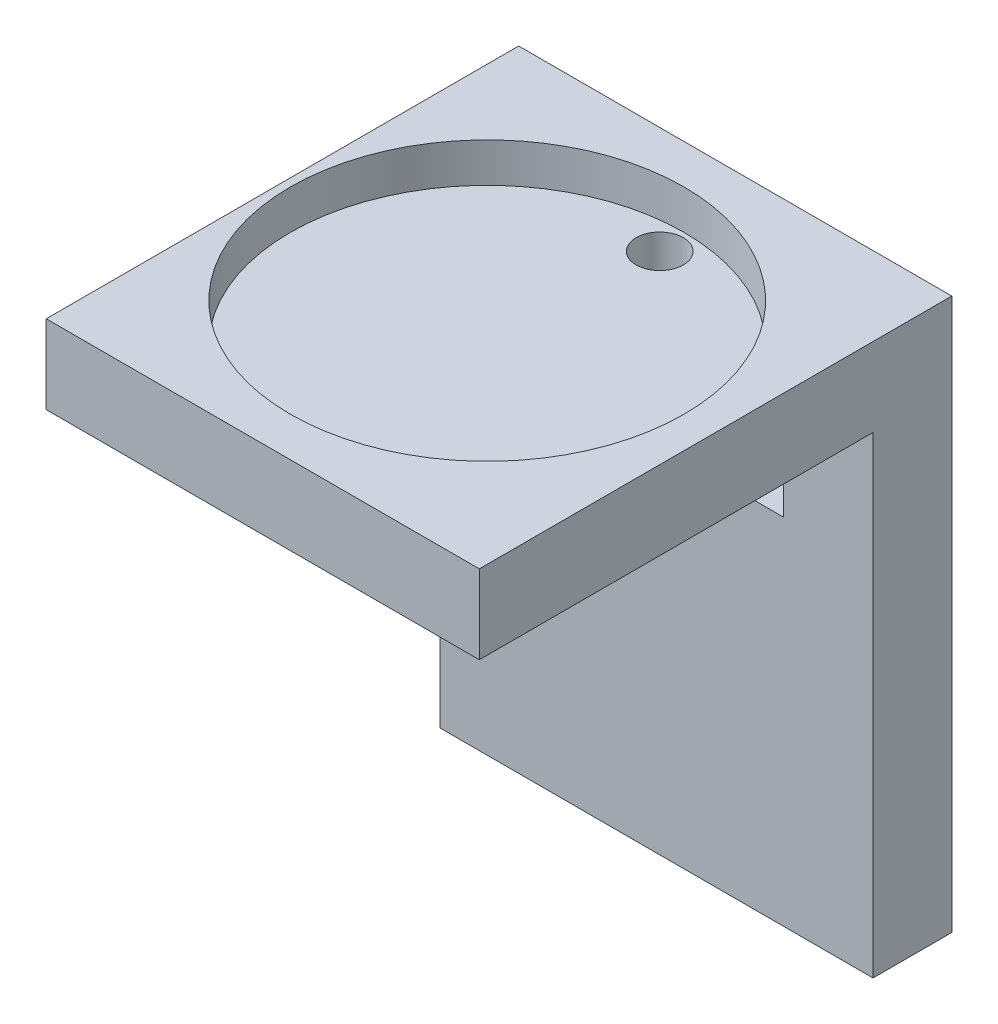
from build123d import *

# Parameters (mm, degrees)
SKETCH1_W                      = 670
SKETCH1_H                      = 120
BOSS_EXTRUDE1_DEPTH            = 530
SKETCH2_W                      = 100
SKETCH2_H                      = 200
SKETCH2_W_2                    = 650
SKETCH2_H_2                    = 250
CUT_EXTRUDE1_DEPTH             = 100
SKETCH3_R                      = 50
CUT_EXTRUDE2_DEPTH             = 260
F_12_0_12_DIAMETER_HOLE2_D     = 12
F_12_0_12_DIAMETER_HOLE2_DEPTH = 30
F_12_0_12_DIAMETER_HOLE2_TIP   = 3.605163714
SKETCH8_W                      = 650
SKETCH8_H                      = 50
BOSS_EXTRUDE2_DEPTH            = 5
SKETCH9_W                      = 10
SKETCH9_H                      = 250
CUT_EXTRUDE3_DEPTH             = 717
CUT_EXTRUDE4_DEPTH             = 5
SKETCH11_W                     = 10
SKETCH11_H                     = 100
BOSS_EXTRUDE3_DEPTH            = 78
BOSS_EXTRUDE3_2_DEPTH          = 78
BOSS_EXTRUDE3_3_DEPTH          = 78
SKETCH12_W                     = 20
SKETCH12_H                     = 30
CUT_EXTRUDE5_DEPTH             = 80
SKETCH15_W                     = 30
SKETCH15_H                     = 23.536156656
SKETCH15_H_2                   = 28.986603691
CUT_EXTRUDE7_DEPTH             = 35
SHELL1_T                       = -3
SKETCH16_W                     = 14
SKETCH16_H                     = 14
CUT_EXTRUDE8_DEPTH             = 35
SKETCH17_W                     = 5.729882812
SKETCH17_H                     = 17.428393554
SKETCH17_W_2                   = 13.369726562
SKETCH17_H_2                   = 3.342431641
BOSS_EXTRUDE4_DEPTH            = 5
CUT_EXTRUDE10_DEPTH            = 863.670273187
CUT_EXTRUDE10_DEPTH_BACK       = 863.670273187
SKETCH18_W                     = 670
SKETCH18_H                     = 250
CUT_EXTRUDE11_DEPTH            = 737.002717386
CUT_EXTRUDE11_DEPTH_BACK       = 737.002717386
SKETCH19_W                     = 222
SKETCH19_H                     = 280
SKETCH19_W_2                   = 338
CUT_EXTRUDE12_DEPTH            = 538.683922021
CUT_EXTRUDE12_DEPTH_BACK       = 538.683922021
SKETCH20_W                     = 110
SKETCH20_H                     = 140


with BuildPart() as part:
    # Sketch1 → Boss-Extrude1 (new body)
    with BuildSketch(Plane(origin=(0, 0, 0), x_dir=(1, 0, 0), z_dir=(0, 1, 0))):
        with Locations((335, 60)):
            Rectangle(SKETCH1_W, SKETCH1_H)
    extrude(amount=BOSS_EXTRUDE1_DEPTH)

    # Sketch2 → Cut-Extrude1 (cut)
    with BuildSketch(Plane.XY):
        with Locations((60, 380)):
            Rectangle(SKETCH2_W, SKETCH2_H)
        with Locations((170, 380)):
            Rectangle(SKETCH2_W, SKETCH2_H)
        with Locations((280, 380)):
            Rectangle(SKETCH2_W, SKETCH2_H)
        with Locations((390, 380)):
            Rectangle(SKETCH2_W, SKETCH2_H)
        with Locations((500, 380)):
            Rectangle(SKETCH2_W, SKETCH2_H)
        with Locations((610, 380)):
            Rectangle(SKETCH2_W, SKETCH2_H)
        with Locations((335, 135)):
            Rectangle(SKETCH2_W_2, SKETCH2_H_2)
    extrude(amount=-CUT_EXTRUDE1_DEPTH, mode=Mode.SUBTRACT)

    # Sketch3 → Cut-Extrude2 (cut)
    with BuildSketch(Plane(origin=(0, 530, 0), x_dir=(1, 0, 0), z_dir=(0, 1, 0))):
        with Locations((60, 60)):
            Circle(SKETCH3_R)
        with Locations((170, 60)):
            Circle(SKETCH3_R)
        with Locations((280, 60)):
            Circle(SKETCH3_R)
        with Locations((390, 60)):
            Circle(SKETCH3_R)
        with Locations((500, 60)):
            Circle(SKETCH3_R)
        with Locations((610, 60)):
            Circle(SKETCH3_R)
    extrude(amount=-CUT_EXTRUDE2_DEPTH, mode=Mode.SUBTRACT)

    # Ø12.0 (12) Diameter Hole2
    with Locations(Plane(origin=(59.704642413, 270, -102.411697903), x_dir=(0, 0, 1), z_dir=(0, 1, 0))):
        with Locations((0, 0), (-0.195888006, 111.8520513), (0.014838595, 221.167624818), (-0.341843303, 331.364008353), (0.657723149, 441.008646429), (1.288998006, 549.811854685)):
            Hole(F_12_0_12_DIAMETER_HOLE2_D / 2, depth=F_12_0_12_DIAMETER_HOLE2_DEPTH)
            with Locations((0, 0, -(F_12_0_12_DIAMETER_HOLE2_DEPTH + F_12_0_12_DIAMETER_HOLE2_TIP / 2))):  # 118° drill point
                Cone(0, F_12_0_12_DIAMETER_HOLE2_D / 2, F_12_0_12_DIAMETER_HOLE2_TIP, mode=Mode.SUBTRACT)

    # Sketch8 → Boss-Extrude2 (add)
    with BuildSketch(Plane.XY):
        with Locations((335, 305)):
            Rectangle(SKETCH8_W, SKETCH8_H)
    extrude(amount=-BOSS_EXTRUDE2_DEPTH)

    # Sketch9 → Cut-Extrude3 (cut)
    with BuildSketch(Plane(origin=(670, 0, 0), x_dir=(0, 0, -1), z_dir=(1, 0, 0))):
        with Locations((15, 135)):
            Rectangle(SKETCH9_W, SKETCH9_H)
    extrude(amount=-CUT_EXTRUDE3_DEPTH, mode=Mode.SUBTRACT)

    # Sketch10 → Cut-Extrude4 (cut)
    with BuildSketch(Plane(origin=(0, 10, 0), x_dir=(1, 0, 0), z_dir=(0, 1, 0))):
        Polygon((365, 61.943560596), (350, 87.924322709), (320, 87.924322709), (305, 61.943560596), (320, 35.962798482), (350, 35.962798482), align=None)
    extrude(amount=-CUT_EXTRUDE4_DEPTH, mode=Mode.SUBTRACT)

    # Sketch12 → Cut-Extrude5 (cut)
    with BuildSketch(Plane.XY.offset(-100)):
        with Locations((85.198613037, 245)):
            Rectangle(SKETCH12_W, SKETCH12_H)
        with Locations((195.198613037, 245)):
            Rectangle(SKETCH12_W, SKETCH12_H)
        with Locations((305.198613037, 245)):
            Rectangle(SKETCH12_W, SKETCH12_H)
        with Locations((415.198613037, 245)):
            Rectangle(SKETCH12_W, SKETCH12_H)
        with Locations((525.198613037, 245)):
            Rectangle(SKETCH12_W, SKETCH12_H)
        with Locations((635.198613037, 245)):
            Rectangle(SKETCH12_W, SKETCH12_H)
    extrude(amount=-CUT_EXTRUDE5_DEPTH, mode=Mode.SUBTRACT)

    # Sketch17 → Boss-Extrude4 (add)
    # profile 1 of 9: a face of its own
    with BuildSketch(Plane.XY):
        with BuildLine():
            Line((527.508830928, 289.835452458), (527.508830928, 307.263846012))
            Line((527.508830928, 307.263846012), (534.861434459, 307.263846012))
            add(Edge.make_bspline(
                [(534.861434459, 307.263846012), (535.181337774, 307.258256848), (535.803061116, 307.24739446), (536.703508491, 307.139069344), (537.544992916, 306.975202489), (538.325061607, 306.737496792), (539.040841948, 306.426020155), (539.698044515, 306.051894954), (540.290333057, 305.605079277), (540.822348212, 305.090232636), (541.284521701, 304.502523111), (541.692171296, 303.852565801), (542.030284458, 303.129762281), (542.309377095, 302.341316546), (542.5243908, 301.484161689), (542.679660381, 300.560045938), (542.773357357, 299.567500804), (542.783368073, 298.883107022), (542.788518428, 298.530997273)],
                knots=[0, 0, 0, 0, 1.135059408, 2.20595691, 3.214417064, 4.174978569, 5.094187092, 5.980001006, 6.853065862, 7.720814779, 8.600404634, 9.50058483, 10.438414914, 11.426825708, 12.465239141, 13.571113463, 14.750376389, 16, 16, 16, 16], degree=3))
            add(Edge.make_bspline(
                [(542.788518428, 298.530997273), (542.781740751, 298.180151665), (542.768592871, 297.499553336), (542.676885992, 296.511518461), (542.516733301, 295.591080531), (542.296748778, 294.736450427), (542.003051046, 293.953120444), (541.654236167, 293.233205539), (541.233025793, 292.585291498), (540.753136904, 292.000029304), (540.204772188, 291.484681411), (539.587651059, 291.044279297), (538.910779309, 290.668464036), (538.169670382, 290.361903209), (537.364073889, 290.124869172), (536.495133477, 289.954199984), (535.562644449, 289.853487388), (534.920131033, 289.841584621), (534.58911581, 289.835452458)],
                knots=[0, 0, 0, 0, 1.228418252, 2.382983832, 3.470276728, 4.496757894, 5.468023682, 6.394867725, 7.292157164, 8.167372942, 9.039072913, 9.918728341, 10.815246345, 11.744296628, 12.720973084, 13.750736166, 14.841206188, 16, 16, 16, 16], degree=3))
            Line((534.58911581, 289.835452458), (527.508830928, 289.835452458))
        make_face()
        with BuildLine():
            Line((533.238713741, 291.745413395), (534.048208904, 291.745413395))
            add(Edge.make_bspline(
                [(534.048208904, 291.745413395), (534.172894012, 291.749291978), (534.413033311, 291.756761998), (534.758676231, 291.825976613), (535.075745017, 291.938271137), (535.365749176, 292.094802589), (535.623404602, 292.300450923), (535.848862806, 292.551404902), (536.04776914, 292.844737637), (536.217685755, 293.190205032), (536.364284647, 293.596533622), (536.481764702, 294.076367921), (536.592118304, 294.630928744), (536.673672739, 295.265507643), (536.740044562, 295.978448886), (536.788346679, 296.768428292), (536.812018936, 297.636801208), (536.817188964, 298.241258393), (536.819890499, 298.55711002)],
                knots=[0, 0, 0, 0, 0.728710832, 1.403472396, 2.052289494, 2.690292559, 3.321919393, 3.970736491, 4.656696891, 5.388631723, 6.217040872, 7.17856157, 8.275589967, 9.523440737, 10.918935818, 12.463926104, 14.152268318, 16, 16, 16, 16], degree=3))
            add(Edge.make_bspline(
                [(536.819890499, 298.55711002), (536.8171426, 298.871715251), (536.811863063, 299.476166083), (536.7886758, 300.343334385), (536.739579947, 301.133216935), (536.674703848, 301.843934916), (536.589660404, 302.476324031), (536.488366458, 303.031681737), (536.362441588, 303.507627045), (536.222158727, 303.914921549), (536.050140993, 304.256514038), (535.858357073, 304.554097881), (535.62547107, 304.79746827), (535.36991257, 305.004888479), (535.079348843, 305.160875844), (534.761320266, 305.273944358), (534.414185903, 305.34216807), (534.172870641, 305.349893944), (534.048208904, 305.353885075)],
                knots=[0, 0, 0, 0, 1.842836665, 3.540640921, 5.080358154, 6.47765669, 7.719902824, 8.816971715, 9.781579111, 10.601733135, 11.334613876, 12.017393917, 12.666641099, 13.29908421, 13.937911793, 14.587567384, 15.270347425, 16, 16, 16, 16], degree=3))
            Line((534.048208904, 305.353885075), (533.238713741, 305.353885075))
            Line((533.238713741, 305.353885075), (533.238713741, 291.745413395))
        make_face(mode=Mode.SUBTRACT)
    # profile 2 of 9: a face of its own
    with BuildSketch(Plane.XY):
        with Locations((547.563420772, 298.549649235)):
            Rectangle(SKETCH17_W, SKETCH17_H)
    # profile 3 of 9: a face of its own
    with BuildSketch(Plane.XY):
        Polygon((564.514324092, 307.263846012), (564.514324092, 305.115139958), (558.545696163, 305.115139958), (558.545696163, 299.862747379), (563.559343624, 299.862747379), (563.559343624, 297.714041325), (558.545696163, 297.714041325), (558.545696163, 289.835452458), (552.81581335, 289.835452458), (552.81581335, 307.263846012), align=None)
    # profile 4 of 9: a face of its own
    with BuildSketch(Plane.XY):
        Polygon((577.645305538, 307.263846012), (577.645305538, 305.115139958), (571.676677608, 305.115139958), (571.676677608, 299.862747379), (576.690325069, 299.862747379), (576.690325069, 297.714041325), (571.676677608, 297.714041325), (571.676677608, 289.835452458), (565.946794795, 289.835452458), (565.946794795, 307.263846012), align=None)
    # profile 5 of 9: a face of its own
    with BuildSketch(Plane.XY):
        with Locations((584.330168819, 287.448001286)):
            Rectangle(SKETCH17_W_2, SKETCH17_H_2)
    # profile 6 of 9: a face of its own
    with BuildSketch(Plane.XY):
        with BuildLine():
            Line((605.578484249, 307.263846012), (605.578484249, 295.602639195))
            add(Edge.make_bspline(
                [(605.578484249, 295.602639195), (605.574209777, 295.35989389), (605.565919345, 294.889083964), (605.480877158, 294.20653885), (605.349958188, 293.569747554), (605.15926554, 292.978838165), (604.911867049, 292.436847071), (604.616163877, 291.936663973), (604.260702644, 291.487723021), (603.847299908, 291.08966617), (603.386881991, 290.731670113), (602.867295001, 290.425440037), (602.293741958, 290.168488385), (601.66690529, 289.960990771), (600.988052682, 289.797299786), (600.254912883, 289.679078851), (599.467035781, 289.60781007), (598.923618241, 289.60048219), (598.643684673, 289.59670734)],
                knots=[0, 0, 0, 0, 1.108173197, 2.149326602, 3.136215123, 4.073726706, 4.978516626, 5.852185058, 6.72141202, 7.584905625, 8.467554395, 9.379216169, 10.332422268, 11.332766067, 12.390653242, 13.518530507, 14.721707419, 16, 16, 16, 16], degree=3))
            add(Edge.make_bspline(
                [(598.643684673, 289.59670734), (598.373688491, 289.600411437), (597.851346557, 289.607577482), (597.093280473, 289.679448684), (596.387523889, 289.797736542), (595.733050135, 289.960122315), (595.130189942, 290.169220301), (594.579048171, 290.42623041), (594.078350789, 290.732835498), (593.633858028, 291.090104794), (593.234289459, 291.486851767), (592.899913678, 291.940746827), (592.609043638, 292.435866034), (592.375223767, 292.980322997), (592.191754821, 293.570441519), (592.063541006, 294.20666921), (591.983676196, 294.889343196), (591.974661767, 295.359932437), (591.970012569, 295.602639195)],
                knots=[0, 0, 0, 0, 1.258901956, 2.435505865, 3.547148904, 4.59359074, 5.576649289, 6.5183682, 7.424469602, 8.307507093, 9.172751023, 10.042627298, 10.928839176, 11.845659241, 12.799442865, 13.80597989, 14.868432463, 16, 16, 16, 16], degree=3))
            Line((591.970012569, 295.602639195), (591.970012569, 307.263846012))
            Line((591.970012569, 307.263846012), (597.699895381, 307.263846012))
            Line((597.699895381, 307.263846012), (597.699895381, 295.457153889))
            add(Edge.make_bspline(
                [(597.699895381, 295.457153889), (597.700816195, 295.287996189), (597.702584578, 294.963135903), (597.729908723, 294.499051493), (597.768241004, 294.079064133), (597.828226169, 293.705517832), (597.90066041, 293.377063412), (597.989882091, 293.09281535), (598.094998068, 292.852496478), (598.225239063, 292.654232043), (598.380826623, 292.495135011), (598.55368342, 292.353231761), (598.757556996, 292.238543846), (598.987648905, 292.146224908), (599.243380948, 292.070549638), (599.526120553, 292.020376099), (599.83553351, 291.990763905), (600.049971942, 291.986424568), (600.161954402, 291.984158512)],
                knots=[0, 0, 0, 0, 1.622370975, 3.115695595, 4.458049099, 5.666011203, 6.742434742, 7.681714947, 8.519814998, 9.250928664, 9.942747364, 10.646898194, 11.389596108, 12.175933929, 13.021386247, 13.943159715, 14.925891993, 16, 16, 16, 16], degree=3))
            add(Edge.make_bspline(
                [(600.161954402, 291.984158512), (600.283927219, 291.987190593), (600.521124756, 291.993087005), (600.86597014, 292.03390861), (601.187714881, 292.103380086), (601.484890424, 292.205377303), (601.758665297, 292.332852529), (602.012761516, 292.484567923), (602.236391413, 292.674631152), (602.439076761, 292.888441291), (602.620738276, 293.128529789), (602.771757722, 293.399928575), (602.905501548, 293.697121508), (603.005823683, 294.025060118), (603.089837826, 294.379999499), (603.146989706, 294.763086929), (603.186210275, 295.174074524), (603.189394751, 295.457053988), (603.191033077, 295.602639195)],
                knots=[0, 0, 0, 0, 1.083870311, 2.107775948, 3.08105344, 4.003637981, 4.893545291, 5.761570557, 6.624657808, 7.49233129, 8.376387281, 9.291996285, 10.246843261, 11.267344133, 12.334180325, 13.486053461, 14.706643157, 16, 16, 16, 16], degree=3))
            Line((603.191033077, 295.602639195), (603.191033077, 307.263846012))
            Line((603.191033077, 307.263846012), (605.578484249, 307.263846012))
        make_face()
    # profile 7 of 9: a face of its own
    with BuildSketch(Plane.XY):
        with BuildLine():
            Line((619.731593227, 302.015183827), (616.739818477, 301.526502415))
            add(Edge.make_bspline(
                [(616.739818477, 301.526502415), (616.748849224, 301.670726223), (616.765660669, 301.939210177), (616.78429066, 302.312269209), (616.796668381, 302.625642376), (616.798628236, 302.814722915), (616.799504756, 302.899286839)],
                knots=[0, 0, 0, 0, 1.261802504, 2.348944521, 3.261585937, 4, 4, 4, 4], degree=3))
            add(Edge.make_bspline(
                [(616.799504756, 302.899286839), (616.798306068, 303.007660677), (616.795968139, 303.219033721), (616.750451916, 303.523894877), (616.694806916, 303.811547356), (616.604352699, 304.076787391), (616.488181329, 304.320314265), (616.348943917, 304.543955606), (616.184187178, 304.745078709), (615.995833421, 304.928129987), (615.778009957, 305.083200131), (615.536269472, 305.218702836), (615.269765326, 305.333844758), (614.978065514, 305.431346685), (614.660683072, 305.504624438), (614.319025281, 305.556776695), (613.952471696, 305.585673441), (613.699597795, 305.590260771), (613.568984889, 305.592630192)],
                knots=[0, 0, 0, 0, 1.079280541, 2.105035848, 3.067950317, 3.99715044, 4.889989748, 5.753421302, 6.617030865, 7.476358039, 8.364190572, 9.274590025, 10.235106994, 11.254473582, 12.337095886, 13.478601727, 14.697662529, 16, 16, 16, 16], degree=3))
            add(Edge.make_bspline(
                [(613.568984889, 305.592630192), (613.391954632, 305.58912286), (613.059112606, 305.582528579), (612.595688488, 305.495339748), (612.198743126, 305.361419257), (611.87165349, 305.163811893), (611.613188167, 304.909795747), (611.433841092, 304.593316589), (611.323009072, 304.224665915), (611.313400221, 303.959558324), (611.308367061, 303.820693775)],
                knots=[0, 0, 0, 0, 1.294917039, 2.43462794, 3.440028966, 4.347597256, 5.210608309, 6.06356377, 6.985685997, 8, 8, 8, 8], degree=3))
            add(Edge.make_bspline(
                [(611.308367061, 303.820693775), (611.317562032, 303.705133219), (611.336106628, 303.472068433), (611.47315858, 303.132808312), (611.695999602, 302.811560885), (612.009295906, 302.510664216), (612.404107796, 302.221967273), (612.884407504, 301.948533431), (613.450813789, 301.688189695), (613.862519081, 301.536023727), (614.080048656, 301.455624958)],
                knots=[0, 0, 0, 0, 0.716839541, 1.445735977, 2.240793036, 3.131329288, 4.131129903, 5.273471266, 6.559404876, 8, 8, 8, 8], degree=3))
            add(Edge.make_bspline(
                [(614.080048656, 301.455624958), (614.335934702, 301.364918412), (614.834564244, 301.188164095), (615.547657928, 300.88707802), (616.213068388, 300.5749594), (616.829579094, 300.246613346), (617.397833174, 299.90520698), (617.914851624, 299.544556457), (618.386199073, 299.173962102), (618.807001026, 298.783874588), (619.177995113, 298.378100064), (619.4958685, 297.952745357), (619.771807525, 297.51723103), (619.991113975, 297.061458502), (620.169645242, 296.594624218), (620.292698657, 296.11024444), (620.364288243, 295.609761088), (620.37516617, 295.270864226), (620.380681514, 295.099036213)],
                knots=[0, 0, 0, 0, 1.359488612, 2.649152603, 3.874964776, 5.039588756, 6.146130126, 7.193090393, 8.194917302, 9.146793662, 10.063845301, 10.944476293, 11.803344532, 12.641736646, 13.473440096, 14.302714936, 15.139439897, 16, 16, 16, 16], degree=3))
            add(Edge.make_bspline(
                [(620.380681514, 295.099036213), (620.374476075, 294.902306495), (620.362285176, 294.515820995), (620.280160209, 293.948630617), (620.138011896, 293.409496554), (619.938489338, 292.895972278), (619.681049879, 292.411946655), (619.366518754, 291.954381076), (618.996510229, 291.525099427), (618.5710008, 291.128381035), (618.102222518, 290.765302239), (617.587803957, 290.450854345), (617.034458515, 290.187092261), (616.444107988, 289.968993032), (615.81453624, 289.801373099), (615.145337453, 289.685291013), (614.438790193, 289.606619894), (613.954683001, 289.600062276), (613.70700941, 289.59670734)],
                knots=[0, 0, 0, 0, 0.972121714, 1.909782367, 2.824924061, 3.721832975, 4.62620438, 5.527836938, 6.46026819, 7.421000932, 8.398101015, 9.385579713, 10.394244048, 11.422703992, 12.491421888, 13.608778581, 14.776629625, 16, 16, 16, 16], degree=3))
            add(Edge.make_bspline(
                [(613.70700941, 289.59670734), (613.445745367, 289.599650312), (612.939893069, 289.605348413), (612.207608113, 289.66709241), (611.525297432, 289.760984454), (610.893395078, 289.899706116), (610.309273131, 290.072394336), (609.776099392, 290.288320955), (609.295310255, 290.547303481), (608.863217672, 290.843007892), (608.478306623, 291.175775461), (608.148120946, 291.551766865), (607.86942369, 291.967163224), (607.639947144, 292.421521488), (607.466477665, 292.917583541), (607.339164663, 293.449829748), (607.264537999, 294.021332449), (607.254747521, 294.414908557), (607.249700069, 294.617815586)],
                knots=[0, 0, 0, 0, 1.342201143, 2.598733168, 3.773451092, 4.878874364, 5.91991243, 6.900006476, 7.829142054, 8.72062616, 9.585588575, 10.436728592, 11.283829734, 12.149664931, 13.044964919, 13.977937424, 14.957531465, 16, 16, 16, 16], degree=3))
            add(Edge.make_bspline(
                [(607.249700069, 294.617815586), (607.250803815, 294.692425759), (607.253213998, 294.855347393), (607.260452266, 295.122772538), (607.275636683, 295.433682216), (607.29037174, 295.656130545), (607.298195171, 295.774237248)],
                knots=[0, 0, 0, 0, 0.773500207, 1.689044709, 2.77302154, 4, 4, 4, 4], degree=3))
            Line((607.298195171, 295.774237248), (610.36457777, 296.337526509))
            add(Edge.make_bspline(
                [(610.36457777, 296.337526509), (610.326952988, 296.136337493), (610.255606535, 295.754830366), (610.178678473, 295.21219969), (610.124206629, 294.733311493), (610.11767002, 294.435147371), (610.114641475, 294.297001835)],
                knots=[0, 0, 0, 0, 1.192988372, 2.262218769, 3.194850416, 4, 4, 4, 4], degree=3))
            add(Edge.make_bspline(
                [(610.114641475, 294.297001835), (610.116191817, 294.183708768), (610.119182568, 293.965156219), (610.159053378, 293.648552813), (610.215988606, 293.352999663), (610.302906772, 293.079707227), (610.411206928, 292.826307836), (610.544682453, 292.59538211), (610.704385489, 292.386485019), (610.887496571, 292.200099922), (611.094689168, 292.033628705), (611.327456494, 291.892756696), (611.58347653, 291.771733922), (611.864681562, 291.677479524), (612.167961721, 291.596080628), (612.497219749, 291.548235723), (612.849461228, 291.512043782), (613.092629543, 291.508500084), (613.218327999, 291.506668278)],
                knots=[0, 0, 0, 0, 1.135776692, 2.191015738, 3.19649269, 4.151244236, 5.061952528, 5.956281389, 6.819534407, 7.692823504, 8.571441916, 9.478554956, 10.416037156, 11.406231466, 12.450054172, 13.561596327, 14.739541482, 16, 16, 16, 16], degree=3))
            add(Edge.make_bspline(
                [(613.218327999, 291.506668278), (613.423996012, 291.510791273), (613.810619321, 291.518541853), (614.349272542, 291.616708407), (614.810575885, 291.768742445), (615.189785268, 291.991387532), (615.490778961, 292.278756613), (615.698005174, 292.637320004), (615.824813318, 293.05638326), (615.837728413, 293.355975238), (615.844524288, 293.513619419)],
                knots=[0, 0, 0, 0, 1.308765556, 2.460272085, 3.475015317, 4.388076298, 5.239673503, 6.095681635, 6.997954785, 8, 8, 8, 8], degree=3))
            add(Edge.make_bspline(
                [(615.844524288, 293.513619419), (615.833808824, 293.638242951), (615.811807312, 293.894126055), (615.644884004, 294.264515838), (615.382382362, 294.620631473), (615.016807277, 294.962984909), (614.551376589, 295.293471235), (613.986957743, 295.616730224), (613.322148235, 295.933112033), (612.83677959, 296.119639164), (612.580430889, 296.21815395)],
                knots=[0, 0, 0, 0, 0.667930748, 1.371427933, 2.146459016, 3.034714139, 4.04893387, 5.207327294, 6.525042705, 8, 8, 8, 8], degree=3))
            add(Edge.make_bspline(
                [(612.580430889, 296.21815395), (612.374354345, 296.29679374), (611.970646869, 296.450850434), (611.394079385, 296.713586304), (610.853066711, 296.987016804), (610.357486361, 297.288235735), (609.896382561, 297.599610528), (609.477036946, 297.932256792), (609.09841673, 298.284556341), (608.758710772, 298.653375077), (608.457302107, 299.038989264), (608.199448649, 299.444659231), (607.977533299, 299.866789834), (607.798609588, 300.308107488), (607.65975715, 300.767821241), (607.559616231, 301.244439392), (607.497905054, 301.739995674), (607.491630423, 302.075933546), (607.488445186, 302.246468159)],
                knots=[0, 0, 0, 0, 1.249558333, 2.447906163, 3.58867143, 4.682264114, 5.731748367, 6.739728761, 7.711906036, 8.659384707, 9.578321416, 10.481344598, 11.379544271, 12.277135726, 13.175418307, 14.097160112, 15.034047388, 16, 16, 16, 16], degree=3))
            add(Edge.make_bspline(
                [(607.488445186, 302.246468159), (607.49282555, 302.439538736), (607.501402184, 302.817565692), (607.587451154, 303.36980586), (607.719291893, 303.894921371), (607.910558542, 304.389343064), (608.156192894, 304.852853762), (608.453187669, 305.288766511), (608.804241719, 305.697593471), (609.213503754, 306.066686531), (609.657214714, 306.407618241), (610.14376173, 306.697651931), (610.658716537, 306.950861947), (611.210636666, 307.148827868), (611.791820619, 307.313252612), (612.408080529, 307.421140415), (613.056315391, 307.490701612), (613.499160755, 307.498567824), (613.725661373, 307.502591129)],
                knots=[0, 0, 0, 0, 1.01033566, 1.978209831, 2.919499157, 3.840961976, 4.746855014, 5.660740114, 6.597989116, 7.56120833, 8.541877795, 9.523498025, 10.522416858, 11.542172371, 12.589598349, 13.681636521, 14.814234488, 16, 16, 16, 16], degree=3))
            add(Edge.make_bspline(
                [(613.725661373, 307.502591129), (613.968269855, 307.498219033), (614.438190994, 307.489750488), (615.120391152, 307.426787419), (615.755073228, 307.319142339), (616.345153155, 307.171557286), (616.887304575, 306.977590666), (617.384933999, 306.742393454), (617.834452216, 306.46201507), (618.236961315, 306.139451502), (618.593086714, 305.773322851), (618.897467704, 305.361641069), (619.158701245, 304.909408454), (619.366684143, 304.412232174), (619.529870326, 303.873247147), (619.649133834, 303.29158184), (619.720420497, 302.667301443), (619.72779778, 302.236712324), (619.731593227, 302.015183827)],
                knots=[0, 0, 0, 0, 1.248314423, 2.417925914, 3.521398822, 4.558068205, 5.543720209, 6.479599284, 7.385061127, 8.263440163, 9.127722873, 10.00561236, 10.891325273, 11.808802823, 12.772251995, 13.784947978, 14.860405143, 16, 16, 16, 16], degree=3))
        make_face()
    # profile 8 of 9: a face of its own
    with BuildSketch(Plane.XY):
        Polygon((633.989153194, 307.263846012), (633.989153194, 305.115139958), (628.020525264, 305.115139958), (628.020525264, 300.340237614), (633.034172725, 300.340237614), (633.034172725, 298.191531559), (628.020525264, 298.191531559), (628.020525264, 291.984158512), (634.944133663, 291.984158512), (634.944133663, 289.835452458), (622.290642452, 289.835452458), (622.290642452, 307.263846012), align=None)
    # profile 9 of 9: a face of its own
    with BuildSketch(Plane.XY):
        with BuildLine():
            Line((636.376604366, 289.835452458), (636.376604366, 307.263846012))
            Line((636.376604366, 307.263846012), (643.990335369, 307.263846012))
            add(Edge.make_bspline(
                [(643.990335369, 307.263846012), (644.237946498, 307.261150834), (644.721600887, 307.25588639), (645.426490561, 307.189203683), (646.094808274, 307.090496236), (646.724915796, 306.949857504), (647.317873659, 306.767252686), (647.871119087, 306.542146), (648.390701058, 306.282329135), (648.864494846, 305.976472528), (649.295093616, 305.642889252), (649.669668547, 305.279483604), (649.990389523, 304.894749072), (650.250664962, 304.483256345), (650.454275633, 304.048690948), (650.59581384, 303.587791605), (650.684089268, 303.104102537), (650.695510601, 302.772834174), (650.701311397, 302.604585835)],
                knots=[0, 0, 0, 0, 1.303269877, 2.545653735, 3.724355284, 4.8584284, 5.941462088, 6.987020715, 8.000098032, 8.995332524, 9.951400474, 10.863507538, 11.737823931, 12.582415999, 13.420128714, 14.25671499, 15.114600608, 16, 16, 16, 16], degree=3))
            add(Edge.make_bspline(
                [(650.701311397, 302.604585835), (650.698282873, 302.472674957), (650.692382063, 302.215658276), (650.651041486, 301.838684287), (650.580643818, 301.480313933), (650.481036683, 301.139915259), (650.347814833, 300.820175594), (650.191279492, 300.517863507), (650.009772227, 300.230553342), (649.788675198, 299.970497982), (649.548268341, 299.722842359), (649.274558803, 299.497116911), (648.974487035, 299.288655528), (648.642526299, 299.104010513), (648.287619671, 298.928055749), (647.899038177, 298.784921972), (647.486819978, 298.644749395), (647.19793098, 298.577036306), (647.049257183, 298.54218845)],
                knots=[0, 0, 0, 0, 1.057156483, 2.059775939, 3.035078039, 3.981068617, 4.897189472, 5.80650904, 6.70770952, 7.613691521, 8.536886357, 9.470937334, 10.45233069, 11.461024139, 12.51295332, 13.623444893, 14.776929983, 16, 16, 16, 16], degree=3))
            add(Edge.make_bspline(
                [(647.049257183, 298.54218845), (647.19164695, 298.499279419), (647.467865022, 298.416041346), (647.856360945, 298.265600017), (648.211652989, 298.111536308), (648.524185739, 297.936781388), (648.807636894, 297.762122504), (649.047122259, 297.564301324), (649.255235567, 297.361673563), (649.425188343, 297.135464734), (649.570253643, 296.882344437), (649.694827156, 296.586596707), (649.815179167, 296.247423665), (649.917667348, 295.859098311), (650.004750555, 295.423699276), (650.088222437, 294.944027189), (650.153853601, 294.416024546), (650.187587341, 294.048412906), (650.2051692, 293.856815525)],
                knots=[0, 0, 0, 0, 1.149282524, 2.229462177, 3.219229774, 4.139917433, 4.995948464, 5.788695735, 6.536448429, 7.236319808, 7.968460079, 8.78645307, 9.713791991, 10.749194692, 11.887975363, 13.146018663, 14.512518948, 16, 16, 16, 16], degree=3))
            add(Edge.make_bspline(
                [(650.2051692, 293.856815525), (650.225980287, 293.627849833), (650.265975604, 293.187817268), (650.348933081, 292.554613589), (650.44386163, 291.974357025), (650.555874504, 291.44528724), (650.681301216, 290.967898855), (650.821280597, 290.540469593), (650.979920039, 290.165788217), (651.10484481, 289.941461656), (651.163880062, 289.835452458)],
                knots=[0, 0, 0, 0, 1.324580516, 2.545615266, 3.678710841, 4.711533017, 5.660403917, 6.521349952, 7.301239649, 8, 8, 8, 8], degree=3))
            Line((651.163880062, 289.835452458), (645.213904094, 289.835452458))
            add(Edge.make_bspline(
                [(645.213904094, 289.835452458), (645.12229736, 290.069847279), (644.935171241, 290.548648246), (644.7595281, 291.319414791), (644.64846922, 292.142514735), (644.635117598, 292.70994511), (644.628232479, 293.002555653)],
                knots=[0, 0, 0, 0, 0.930410518, 1.900560147, 2.917368081, 4, 4, 4, 4], degree=3))
            Line((644.628232479, 293.002555653), (644.605850124, 294.002300831))
            Line((644.605850124, 294.002300831), (644.579737377, 295.266903874))
            add(Edge.make_bspline(
                [(644.579737377, 295.266903874), (644.573694669, 295.477395004), (644.562357007, 295.872330118), (644.469348432, 296.426164013), (644.30178735, 296.894645884), (644.073222546, 297.287223005), (643.766741442, 297.590613479), (643.39104803, 297.804152917), (642.950456912, 297.93396284), (642.634664848, 297.946292392), (642.468335247, 297.952786442)],
                knots=[0, 0, 0, 0, 1.295300309, 2.430314163, 3.439929415, 4.342995669, 5.203512789, 6.060756153, 6.978588463, 8, 8, 8, 8], degree=3))
            Line((642.468335247, 297.952786442), (642.106487178, 297.952786442))
            Line((642.106487178, 297.952786442), (642.106487178, 289.835452458))
            Line((642.106487178, 289.835452458), (636.376604366, 289.835452458))
        make_face()
        with BuildLine():
            Line((642.106487178, 299.862747379), (642.617550945, 299.862747379))
            add(Edge.make_bspline(
                [(642.617550945, 299.862747379), (642.722054451, 299.865172716), (642.925280724, 299.869889229), (643.220054897, 299.898289891), (643.494111408, 299.951809873), (643.749840966, 300.021017819), (643.984372137, 300.114851792), (644.200147241, 300.225818296), (644.391160406, 300.362685327), (644.565327067, 300.516342321), (644.718148635, 300.691986294), (644.850351299, 300.889034217), (644.961199162, 301.106225057), (645.056078491, 301.342818683), (645.125883912, 301.600830857), (645.173262731, 301.879472914), (645.203404658, 302.177423605), (645.207875435, 302.383174491), (645.210173702, 302.488943669)],
                knots=[0, 0, 0, 0, 1.184986479, 2.304423995, 3.352332712, 4.347714965, 5.303263624, 6.211353909, 7.091434645, 7.960150225, 8.839440182, 9.723126897, 10.64371617, 11.599264829, 12.608232147, 13.667459739, 14.800924404, 16, 16, 16, 16], degree=3))
            add(Edge.make_bspline(
                [(645.210173702, 302.488943669), (645.207875435, 302.594712847), (645.203404658, 302.800463732), (645.173262731, 303.098414423), (645.125883912, 303.37705648), (645.056078491, 303.635068654), (644.961199162, 303.87166228), (644.850351299, 304.08885312), (644.718148635, 304.285901043), (644.565327067, 304.461545017), (644.391160406, 304.61520201), (644.200147241, 304.752069041), (643.984372137, 304.863035546), (643.749840966, 304.956869518), (643.494111408, 305.026077464), (643.220054897, 305.079597446), (642.925280724, 305.107998108), (642.722054451, 305.112714621), (642.617550945, 305.115139958)],
                knots=[0, 0, 0, 0, 1.199075596, 2.332540261, 3.391767853, 4.400735171, 5.35628383, 6.276873103, 7.160559818, 8.039849775, 8.908565355, 9.788646091, 10.696736376, 11.652285035, 12.647667288, 13.695576005, 14.815013521, 16, 16, 16, 16], degree=3))
            Line((642.617550945, 305.115139958), (642.106487178, 305.115139958))
            Line((642.106487178, 305.115139958), (642.106487178, 299.862747379))
        make_face(mode=Mode.SUBTRACT)
    extrude(amount=BOSS_EXTRUDE4_DEPTH)

    # Sketch18 → Cut-Extrude10 (cut, two sides: drawn at the far end of the back side and taken through both)
    with BuildSketch(Plane.XY.offset(-CUT_EXTRUDE10_DEPTH_BACK)):
        with Locations((335, 405)):
            Rectangle(SKETCH18_W, SKETCH18_H)
    extrude(amount=CUT_EXTRUDE10_DEPTH + CUT_EXTRUDE10_DEPTH_BACK, mode=Mode.SUBTRACT)

    # Sketch19 → Cut-Extrude11 (cut, two sides: drawn at the far end of the back side and taken through both)
    with BuildSketch(Plane(origin=(0, 0, -120), x_dir=(-1, 0, 0), z_dir=(0, 0, -1)).offset(-CUT_EXTRUDE11_DEPTH_BACK)):
        with Locations((-559, 140)):
            Rectangle(SKETCH19_W, SKETCH19_H)
        with Locations((-169, 140)):
            Rectangle(SKETCH19_W_2, SKETCH19_H)
    extrude(amount=CUT_EXTRUDE11_DEPTH + CUT_EXTRUDE11_DEPTH_BACK, mode=Mode.SUBTRACT)

    # Sketch20 → Cut-Extrude12 (cut, two sides: drawn at the far end of the back side and taken through both)
    with BuildSketch(Plane.XY.offset(-100).offset(-CUT_EXTRUDE12_DEPTH_BACK)):
        with Locations((393, 70)):
            Rectangle(SKETCH20_W, SKETCH20_H)
    extrude(amount=CUT_EXTRUDE12_DEPTH + CUT_EXTRUDE12_DEPTH_BACK, mode=Mode.SUBTRACT)


with BuildPart() as body_2:
    # Sketch11 → Boss-Extrude3 (new body)
    with BuildSketch(Plane.XY.offset(-100)):
        with Locations((255, 60)):
            Rectangle(SKETCH11_W, SKETCH11_H)
    extrude(amount=BOSS_EXTRUDE3_DEPTH)


with BuildPart() as body_3:
    # Sketch11 → Boss-Extrude3 2 (new body)
    with BuildSketch(Plane.XY.offset(-100)):
        with Locations((415, 60)):
            Rectangle(SKETCH11_W, SKETCH11_H)
    extrude(amount=BOSS_EXTRUDE3_2_DEPTH)


with BuildPart() as body_4:
    # Sketch11 → Boss-Extrude3 3 (new body)
    with BuildSketch(Plane.XY.offset(-100)):
        Polygon((25, 198.45686471), (325, 145.558770497), (325, 122.01775856), (345, 122.01775856), (345, 145.558770497), (645, 198.45686471), align=None)
    extrude(amount=BOSS_EXTRUDE3_3_DEPTH)

    # Sketch15 → Cut-Extrude7 (cut)
    with BuildSketch(Plane(origin=(345, 0, 0), x_dir=(0, 0, -1), z_dir=(1, 0, 0))):
        with Locations((35, 133.231921672)):
            Rectangle(SKETCH15_W, SKETCH15_H)
        with Locations((85, 130.506698154)):
            Rectangle(SKETCH15_W, SKETCH15_H_2)
    extrude(amount=-CUT_EXTRUDE7_DEPTH, mode=Mode.SUBTRACT)

    # Shell1
    shell1_openings = [body_4.faces().sort_by_distance(p)[0] for p in [
        (335, 198.45686471, -61),
    ]]
    offset(amount=SHELL1_T, openings=shell1_openings, kind=Kind.INTERSECTION)

    # Sketch16 → Cut-Extrude8 (cut)
    with BuildSketch(Plane.XZ.offset(-122.01775856)):
        with Locations((335, -60)):
            Rectangle(SKETCH16_W, SKETCH16_H)
    extrude(amount=-CUT_EXTRUDE8_DEPTH, mode=Mode.SUBTRACT)


solid = part.part
